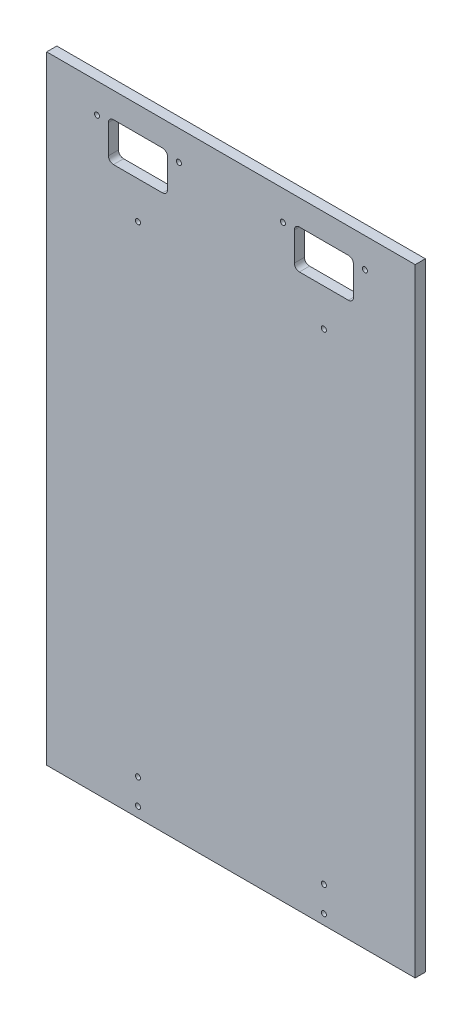
from build123d import *

# Parameters (mm, degrees)
SKETCH_1_R      = 1.5
SKETCH_1_W      = 35
SKETCH_1_H      = 23
EXTRUDE_1_DEPTH = 6
FILLET_1_R      = 3


with BuildPart() as part:
    # Эскиз1 → Бобышка-Вытянуть1 (new body)
    with BuildSketch(Plane.XY):
        Polygon((-109, 326), (109, 326), (109, -39.5), (-109.000135664, -39.5), align=None)
        with Locations((-55, -33.5)):
            Circle(SKETCH_1_R, mode=Mode.SUBTRACT)
        with Locations((-55, -18.5)):
            Circle(SKETCH_1_R, mode=Mode.SUBTRACT)
        with Locations(Location((55, -18.5, 0), (0, 0, 180))):
            Circle(SKETCH_1_R, mode=Mode.SUBTRACT)
        with Locations(Location((55, -33.5, 0), (0, 0, 180))):
            Circle(SKETCH_1_R, mode=Mode.SUBTRACT)
        with Locations((-79.25, 308.5)):
            Circle(SKETCH_1_R, mode=Mode.SUBTRACT)
        with Locations((-55, 266)):
            Circle(SKETCH_1_R, mode=Mode.SUBTRACT)
        with Locations(Location((-30.75, 308.5, 0), (0, 0, 180))):
            Circle(SKETCH_1_R, mode=Mode.SUBTRACT)
        with Locations((30.75, 308.5)):
            Circle(SKETCH_1_R, mode=Mode.SUBTRACT)
        with Locations(Location((55, 266, 0), (0, 0, 180))):
            Circle(SKETCH_1_R, mode=Mode.SUBTRACT)
        with Locations(Location((79.25, 308.5, 0), (0, 0, 180))):
            Circle(SKETCH_1_R, mode=Mode.SUBTRACT)
        with Locations((55, 299.5)):
            Rectangle(SKETCH_1_W, SKETCH_1_H, mode=Mode.SUBTRACT)
        with Locations((-55, 299.5)):
            Rectangle(SKETCH_1_W, SKETCH_1_H, mode=Mode.SUBTRACT)
    extrude(amount=EXTRUDE_1_DEPTH)

    # Скругление1
    fillet_1_edges = [part.edges().sort_by_distance(p)[0] for p in [
        (-72.5, 311, 3),
        (-72.5, 288, 3),
        (-37.5, 288, 3),
        (-37.5, 311, 3),
        (37.5, 288, 3),
        (72.5, 288, 3),
        (72.5, 311, 3),
        (37.5, 311, 3),
    ]]
    fillet(fillet_1_edges, radius=FILLET_1_R)


solid = part.part
